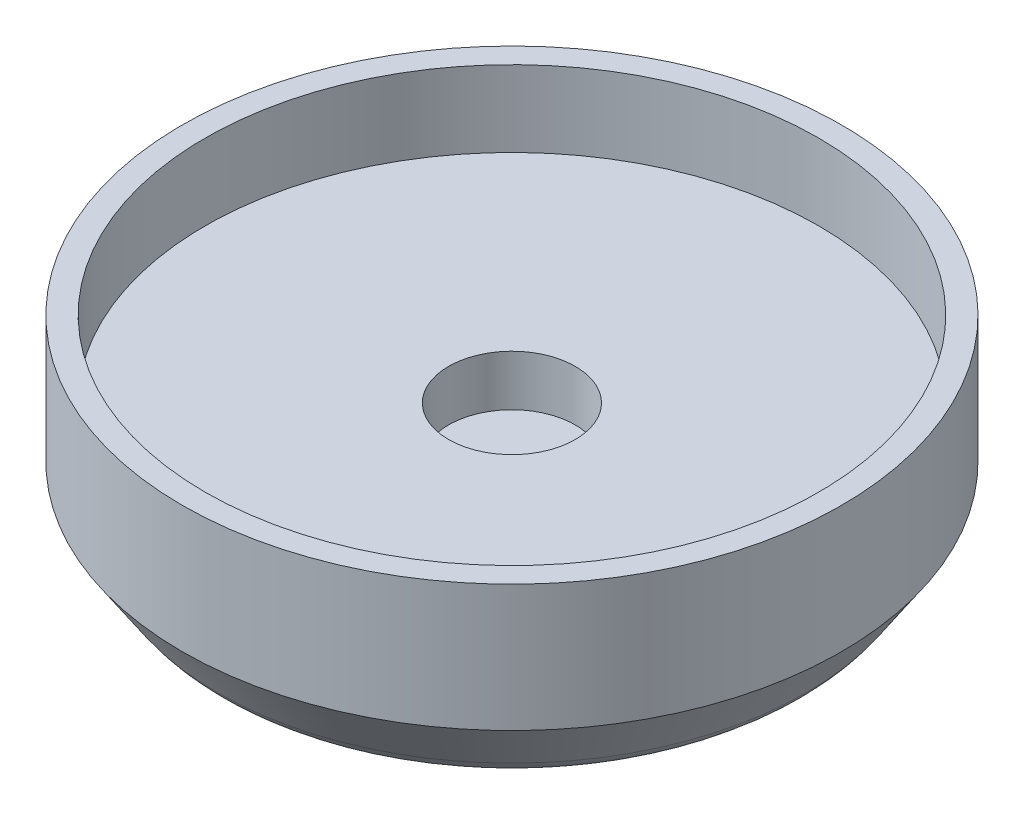
from build123d import *

# Parameters (mm, degrees)
SKETCH_1_R          = 13
EXTRUDE_1_DEPTH     = 5
SKETCH_2_R          = 12
CUT_EXTRUDE_1_DEPTH = 3
SKETCH_3_R          = 2.5
CUT_EXTRUDE_2_DEPTH = 2
SKETCH_4_R          = 11
FILLET_1_R          = 2
SKETCH_7_R          = 12.1
CUT_EXTRUDE_3_DEPTH = 20.05255902


with BuildPart() as part:
    # 草图1 → 凸台-拉伸1 (new body)
    with BuildSketch(Plane(origin=(0, 0, 0), x_dir=(1, 0, 0), z_dir=(0, 1, 0))):
        with Locations(Location((0, 0, 0), (0, 0, 270))):
            Circle(SKETCH_1_R)
    extrude(amount=EXTRUDE_1_DEPTH)

    # 草图2 → 切除-拉伸1 (cut)
    with BuildSketch(Plane(origin=(0, 5, 0), x_dir=(1, 0, 0), z_dir=(0, 1, 0))):
        with Locations(Location((0, 0, 0), (0, 0, 270))):
            Circle(SKETCH_2_R)
    extrude(amount=-CUT_EXTRUDE_1_DEPTH, mode=Mode.SUBTRACT)

    # 草图3 → 切除-拉伸2 (cut)
    with BuildSketch(Plane(origin=(0, 2, 0), x_dir=(1, 0, 0), z_dir=(0, 1, 0))):
        with Locations(Location((0, 0, 0), (0, 0, 270))):
            Circle(SKETCH_3_R)
    extrude(amount=-CUT_EXTRUDE_2_DEPTH, mode=Mode.SUBTRACT)

    # 草图4 → section 0 of loft_1
    with BuildSketch(Plane(origin=(0, -3, 0), x_dir=(-1, 0, 0), z_dir=(0, -1, 0)), mode=Mode.PRIVATE) as loft_1_s0:
        Circle(SKETCH_4_R)
    # loft up to a face of the part (loft_1)
    loft([loft_1_s0.sketch, Face(Wire([part.edges().sort_by_distance((-9.476592156, 0, -8.899112377))[0]]))])

    # 圆角1
    fillet_1_edges = [part.edges().sort_by_distance(p)[0] for p in [
        (11, -3, 0),
    ]]
    fillet(fillet_1_edges, radius=FILLET_1_R)

    # 草图7 → 切除-拉伸3 (cut, through all)
    with BuildSketch(Plane(origin=(0, 2, 0), x_dir=(1, 0, 0), z_dir=(0, 1, 0))):
        with Locations(Location((0, 0, 0), (0, 0, 270))):
            Circle(SKETCH_7_R)
    extrude(amount=CUT_EXTRUDE_3_DEPTH, mode=Mode.SUBTRACT)


solid = part.part
